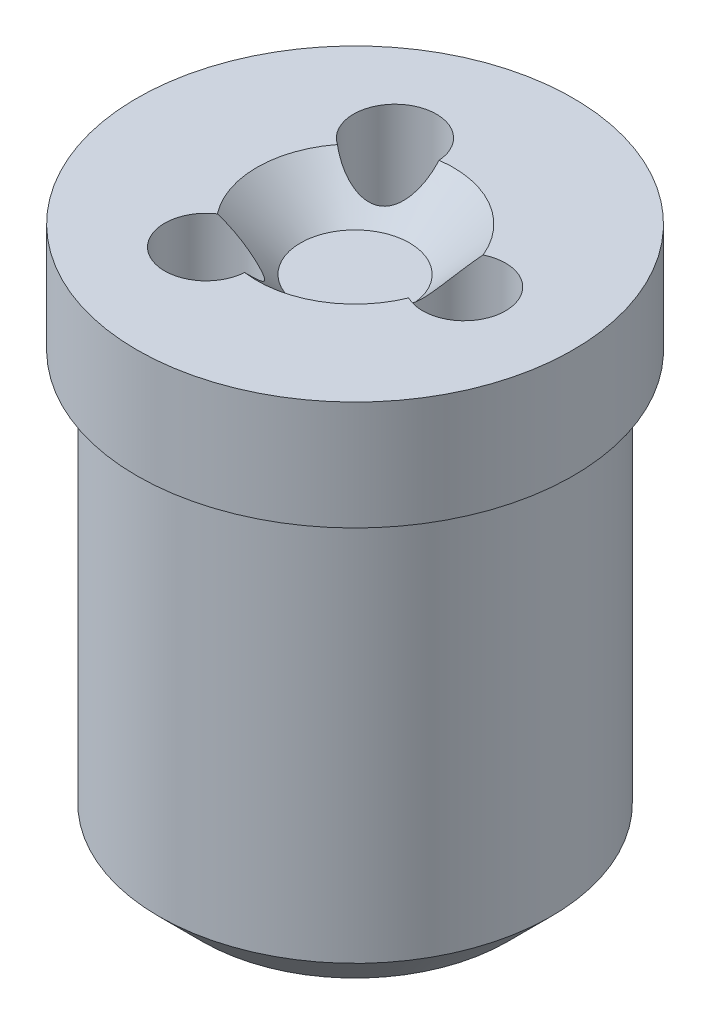
from build123d import *

# Parameters (mm, degrees)
SKETCH_1_R          = 8.99
EXTRUDE_1_DEPTH     = 20
SKETCH_2_R          = 10
EXTRUDE_2_DEPTH     = 5
CHAMFER_1_SIZE      = 2
SKETCH_3_R          = 1.9
CUT_EXTRUDE_1_DEPTH = 36


with BuildPart() as part:
    # 草图1 → 凸台-拉伸1 (new body)
    with BuildSketch(Plane(origin=(0, 0, 0), x_dir=(1, 0, 0), z_dir=(0, 1, 0))):
        with Locations(Location((0, 0, 0), (0, 0, 270))):
            Circle(SKETCH_1_R)
    extrude(amount=EXTRUDE_1_DEPTH)

    # 草图2 → 凸台-拉伸2 (add)
    with BuildSketch(Plane(origin=(0, 20, 0), x_dir=(1, 0, 0), z_dir=(0, 1, 0))):
        with Locations(Location((0, 0, 0), (0, 0, 270))):
            Circle(SKETCH_2_R)
    extrude(amount=EXTRUDE_2_DEPTH)

    # 倒角1
    chamfer_1_edges = [part.edges().sort_by_distance(p)[0] for p in [
        (0, 0, -8.99),
    ]]
    chamfer(chamfer_1_edges, length=CHAMFER_1_SIZE)

    # 草图3 → 切除-拉伸1 (cut)
    with BuildSketch(Plane(origin=(0, 25, 0), x_dir=(1, 0, 0), z_dir=(0, 1, 0))):
        with Locations(Location((5, 0, 0), (0, 0, 270))):
            Circle(SKETCH_3_R)
        with Locations(Location((-2.5, -4.330127019, 0), (0, 0, 270))):
            Circle(SKETCH_3_R)
        with Locations(Location((-2.5, 4.330127019, 0), (0, 0, 270))):
            Circle(SKETCH_3_R)
    extrude(amount=-CUT_EXTRUDE_1_DEPTH, mode=Mode.SUBTRACT)

    # 草图5 → 切除-旋转1 (revolve, cut)
    with BuildSketch(Plane.XY, mode=Mode.PRIVATE) as cut_revolve_1_sk:
        Polygon((0, 23), (-2.5, 23), (-5.780837962, 26.280837962), (0, 26.280837962), align=None)
    revolve(cut_revolve_1_sk.sketch.rotate(Axis((0, 0, 0), (0, 1, 0)), 82.281327408), axis=Axis((0, 0, 0), (0, 1, 0)), mode=Mode.SUBTRACT)


solid = part.part
